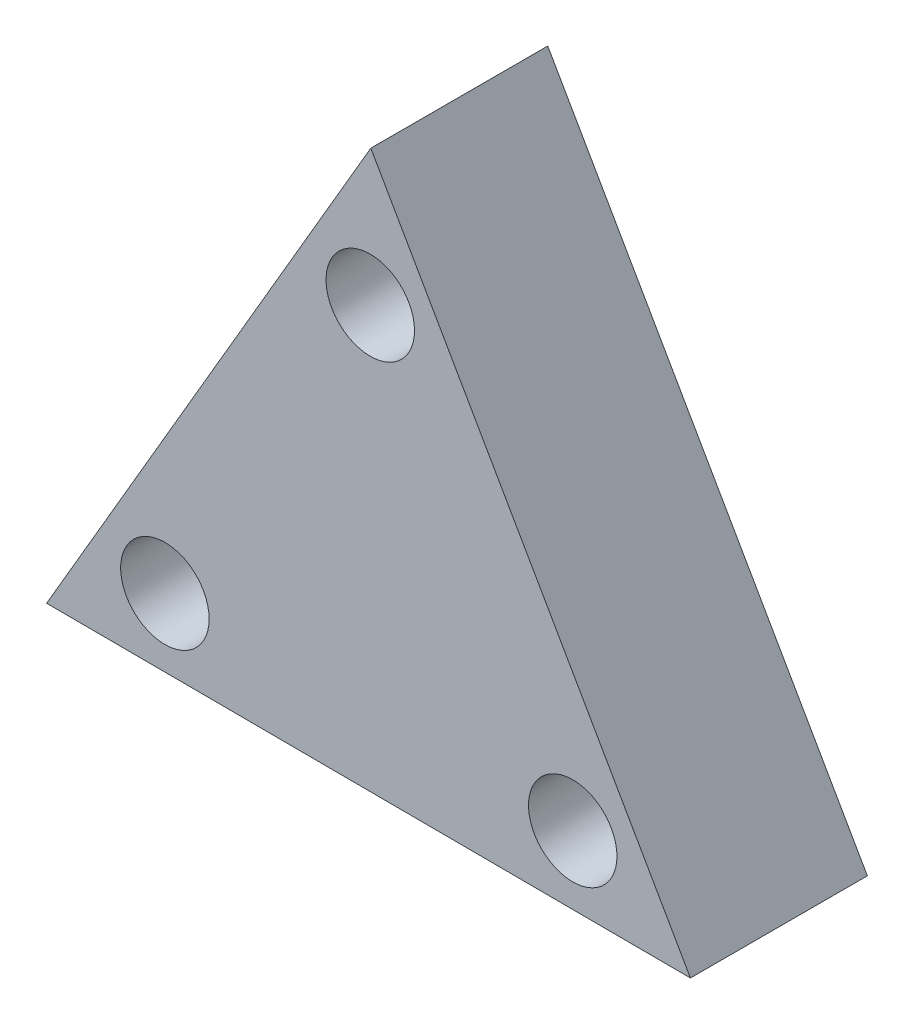
from build123d import *

# Parameters (mm, degrees)
BOSS_EXTRU_1_DEPTH      = 6
ESQUISSE14_R            = 1.5
ENL_V_MAT_EXTRU_1_DEPTH = 8


with BuildPart() as part:
    # Esquisse13 → Boss.-Extru.1 (new body)
    with BuildSketch(Plane.XY):
        Polygon((0.044605576, 12.611770032), (-10.948101074, -6.248487138), (10.881714082, -6.338321768), align=None)
    extrude(amount=BOSS_EXTRU_1_DEPTH)

    # Esquisse14 → Enlèv. mat.-Extru.1 (cut)
    with BuildSketch(Plane.XY.offset(6)):
        with Locations((0.025841827, 7.991160973)):
            Circle(ESQUISSE14_R)
        with Locations((6.891022326, -4.010372012)):
            Circle(ESQUISSE14_R)
        with Locations((-6.937774801, -3.955049343)):
            Circle(ESQUISSE14_R)
    extrude(amount=-ENL_V_MAT_EXTRU_1_DEPTH, mode=Mode.SUBTRACT)


solid = part.part
